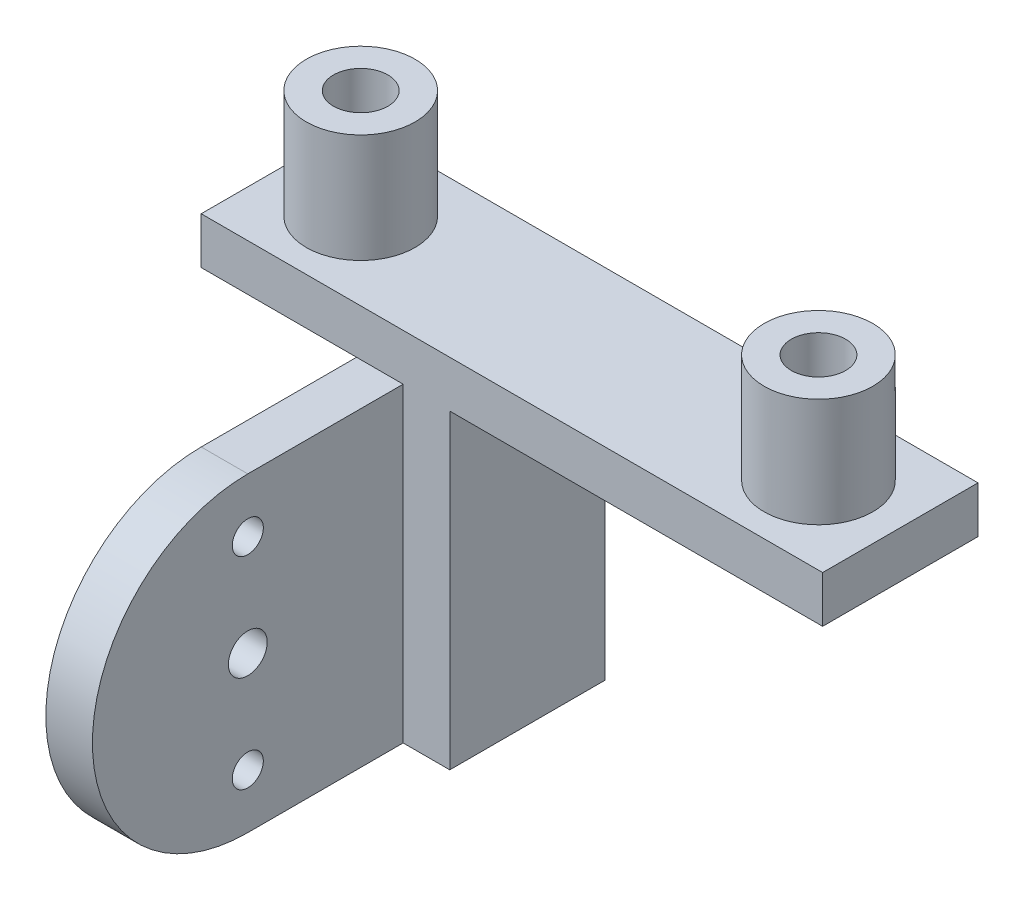
from build123d import *

# Parameters (mm, degrees)
SKETCH_1_W      = 40
SKETCH_1_H      = 10
SKETCH_1_R      = 1.75
EXTRUDE_1_DEPTH = 3
EXTRUDE_START   = -10
SKETCH_2_R      = 1
SKETCH_2_R_2    = 1.25
EXTRUDE_2_DEPTH = 3
SKETCH_3_W      = 3
SKETCH_3_H      = 10
EXTRUDE_3_DEPTH = 20
SKETCH_4_R      = 3.5
SKETCH_4_R_2    = 1.75
EXTRUDE_4_DEPTH = 7


with BuildPart() as part:
    # 草图1 → 凸台-拉伸1 (new body)
    with BuildSketch(Plane(origin=(0, 0, 0), x_dir=(1, 0, 0), z_dir=(0, 1, 0))):
        Rectangle(SKETCH_1_W, SKETCH_1_H)
        with Locations(Location((-14.732, 0, 0), (0, 0, 270))):
            Circle(SKETCH_1_R, mode=Mode.SUBTRACT)
        with Locations(Location((14.732, 0, 0), (0, 0, 270))):
            Circle(SKETCH_1_R, mode=Mode.SUBTRACT)
    extrude(amount=EXTRUDE_1_DEPTH)

    # 草图2 → 凸台-拉伸2 (add)
    with BuildSketch(Plane(origin=(0, 0, 0), x_dir=(0, 0, -1), z_dir=(1, 0, 0)).offset(EXTRUDE_START)):
        with BuildLine():
            Line((5, 0), (-15, 0))
            ThreePointArc((-15, 0), (-25, -10), (-15, -20))
            Line((-15, -20), (5, -20))
            Line((5, -20), (5, 0))
        make_face()
        with Locations((-15, -3.5)):
            Circle(SKETCH_2_R, mode=Mode.SUBTRACT)
        with Locations((-15, -16.5)):
            Circle(SKETCH_2_R, mode=Mode.SUBTRACT)
        with Locations((-15, -10)):
            Circle(SKETCH_2_R_2, mode=Mode.SUBTRACT)
    extrude(amount=EXTRUDE_2_DEPTH)

    # 草图3 → 凸台-拉伸3 (add)
    with BuildSketch(Plane.XZ):
        with Locations((-5.5, 0)):
            Rectangle(SKETCH_3_W, SKETCH_3_H)
    extrude(amount=EXTRUDE_3_DEPTH)

    # 草图4 → 凸台-拉伸4 (add)
    # profile 1 of 2: a face of its own
    with BuildSketch(Plane(origin=(0, 3, 0), x_dir=(1, 0, 0), z_dir=(0, 1, 0))):
        with Locations(Location((-14.732, 0, 0), (0, 0, 270))):
            Circle(SKETCH_4_R)
        with Locations(Location((-14.732, 0, 0), (0, 0, 270))):
            Circle(SKETCH_4_R_2, mode=Mode.SUBTRACT)
    # profile 2 of 2: a face of its own
    with BuildSketch(Plane(origin=(0, 3, 0), x_dir=(1, 0, 0), z_dir=(0, 1, 0))):
        with Locations(Location((14.732, 0, 0), (0, 0, 90))):
            Circle(SKETCH_4_R)
        with Locations(Location((14.732, 0, 0), (0, 0, 270))):
            Circle(SKETCH_4_R_2, mode=Mode.SUBTRACT)
    extrude(amount=EXTRUDE_4_DEPTH)


solid = part.part
